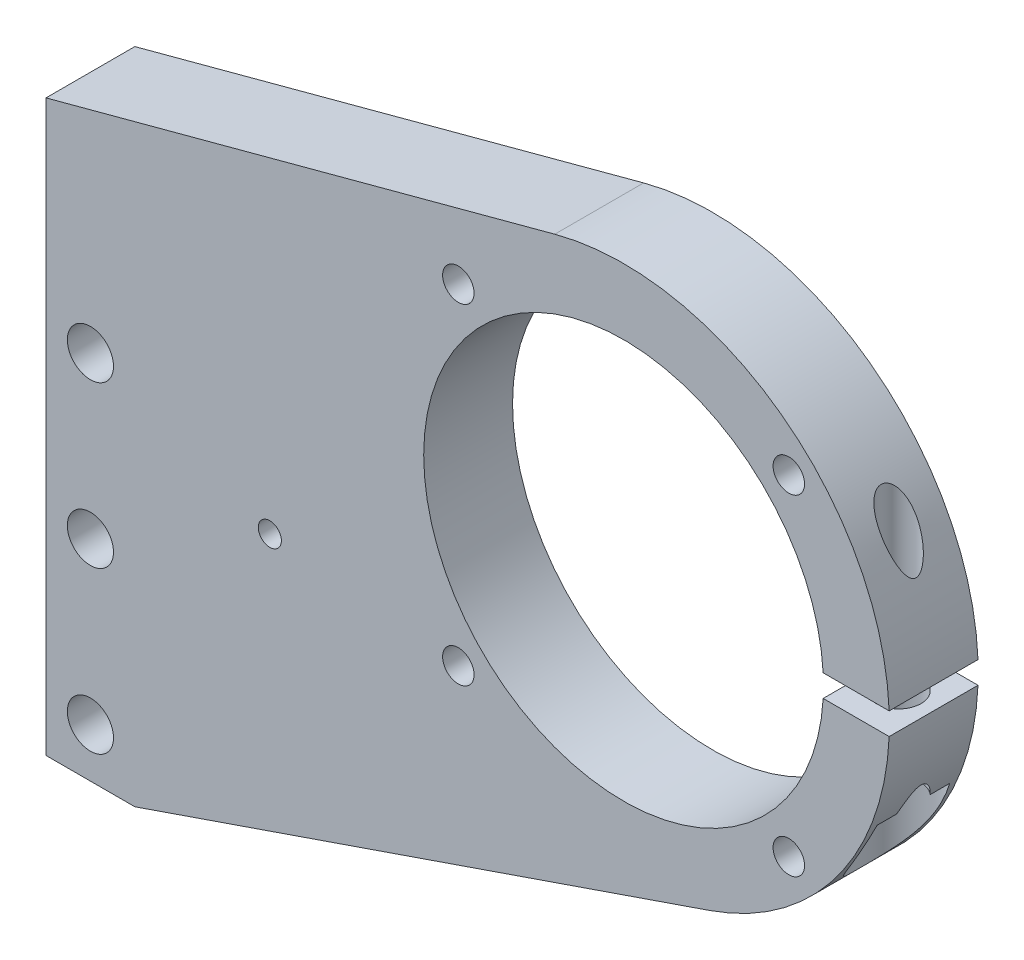
from build123d import *

# Parameters (mm, degrees)
BOSS_EXTRUDE1_DEPTH        = 12.7
CUT_EXTRUDE1_DEPTH         = 270.19769127
SKETCH3_W                  = 28.575
SKETCH3_H                  = 12.7
F_8_CLEARANCE_HOLE1_D      = 4.5
F_1_4_CLEARANCE_HOLE1_D    = 6.6
F_12_CLEARANCE_HOLE1_D     = 6
HOLE1_D                    = 6.4
HOLE1_DEPTH                = 24.77643101
HOLE1_CBORE_D              = 11.2
HOLE1_CBORE_DEPTH          = 11.77643101
F_10_CLEARANCE_HOLE1_D     = 5
F_10_CLEARANCE_HOLE1_DEPTH = 36.4125
CHAMFER1_SIZE              = 3
SKETCH14_R                 = 3
SKETCH14_R_2               = 1.651
BOSS_EXTRUDE2_DEPTH        = 12.7


with BuildPart() as part:
    # Sketch1 → Boss-Extrude1 (new body)
    with BuildSketch(Plane(origin=(0, 0, 0), x_dir=(-1, 0, 0), z_dir=(0, 0, -1))):
        with BuildLine():
            Line((224.169455465, 127.72254562), (151.435240745, 147.211619716))
            ThreePointArc((151.435240745, 147.211619716), (105.257753851, 121.607458019), (129.246532787, 74.570537656))
            Line((129.246532787, 74.570537656), (211.469455465, 46.304993078))
            Line((211.469455465, 46.304993078), (224.169455465, 46.304993078))
            Line((224.169455465, 46.304993078), (224.169455465, 127.72254562))
        make_face()
    extrude(amount=-BOSS_EXTRUDE1_DEPTH)

    # Sketch2 → Cut-Extrude1 (cut, through all)
    with BuildSketch(Plane.XY.offset(12.7)):
        with BuildLine():
            Line((-103.633291463, 112.093938317), (-113.179018515, 112.093938317))
            ThreePointArc((-113.179018515, 112.093938317), (-113.134717032, 110.506438317), (-113.179018515, 108.918938317))
            Line((-113.179018515, 108.918938317), (-103.633291463, 108.918938317))
            ThreePointArc((-103.633291463, 108.918938317), (-103.600117032, 110.506438317), (-103.633291463, 112.093938317))
        make_face()
    extrude(amount=-CUT_EXTRUDE1_DEPTH, mode=Mode.SUBTRACT)

    # Sketch3 → Cut-Revolve1 (revolve, cut)
    with BuildSketch(Plane(origin=(0, 110.506438317, 0), x_dir=(1, 0, 0), z_dir=(0, 1, 0))):
        with Locations((-127.312617032, -6.35)):
            Rectangle(SKETCH3_W, SKETCH3_H)
    revolve(axis=Axis((-141.600117032, 110.506438317, 0), (0, 0, 1)), mode=Mode.SUBTRACT)

    # #8 Clearance Hole1 (through all)
    with Locations(Plane.XY.offset(12.7)):
        with Locations((-117.978117032, 86.884438317), (-165.222117032, 86.884438317), (-165.222117032, 134.128438317), (-117.978117032, 134.128438317)):
            Hole(F_8_CLEARANCE_HOLE1_D / 2)

    # 1/4 Clearance Hole1 (through all)
    with Locations(Plane(origin=(0, 0, 0), x_dir=(-1, 0, 0), z_dir=(0, 0, -1))):
        with Locations((217.819455465, 53.304993078), (217.819455465, 76.304993078), (217.819455465, 99.304993078)):
            Hole(F_1_4_CLEARANCE_HOLE1_D / 2)

    # #12 Clearance Hole1 (through all)
    with Locations(Plane.XY.offset(12.7)):
        with Locations((-192.169455465, 89.72254562)):
            Hole(F_12_CLEARANCE_HOLE1_D / 2)

    # Hole1
    with Locations(Plane(origin=(0, 84.142507307, 0), x_dir=(-1, 0, 0), z_dir=(0, -1, 0))):
        with Locations((108.633291463, -6.35)):
            CounterBoreHole(HOLE1_D / 2, HOLE1_CBORE_D / 2, HOLE1_CBORE_DEPTH, depth=HOLE1_DEPTH)

    # #10 Clearance Hole1
    with Locations(Plane(origin=(0, 112.093938317, 0), x_dir=(-1, 0, 0), z_dir=(0, -1, 0))):
        with Locations((108.633291463, -6.35)):
            Hole(F_10_CLEARANCE_HOLE1_D / 2, depth=F_10_CLEARANCE_HOLE1_DEPTH)

    # Chamfer1
    chamfer1_edges = [part.edges().sort_by_distance(p)[0] for p in [
        (-221.119455465, 99.304993078, 0),
        (-221.119455465, 76.304993078, 0),
        (-221.119455465, 53.304993078, 0),
    ]]
    chamfer(chamfer1_edges, length=CHAMFER1_SIZE)

    # Sketch14 → Boss-Extrude2 (add)
    with BuildSketch(Plane(origin=(0, 0, 0), x_dir=(-1, 0, 0), z_dir=(0, 0, -1))):
        with Locations((192.169455465, 89.72254562)):
            Circle(SKETCH14_R)
        with Locations((192.169455465, 89.72254562)):
            Circle(SKETCH14_R_2, mode=Mode.SUBTRACT)
    extrude(amount=-BOSS_EXTRUDE2_DEPTH)


solid = part.part
